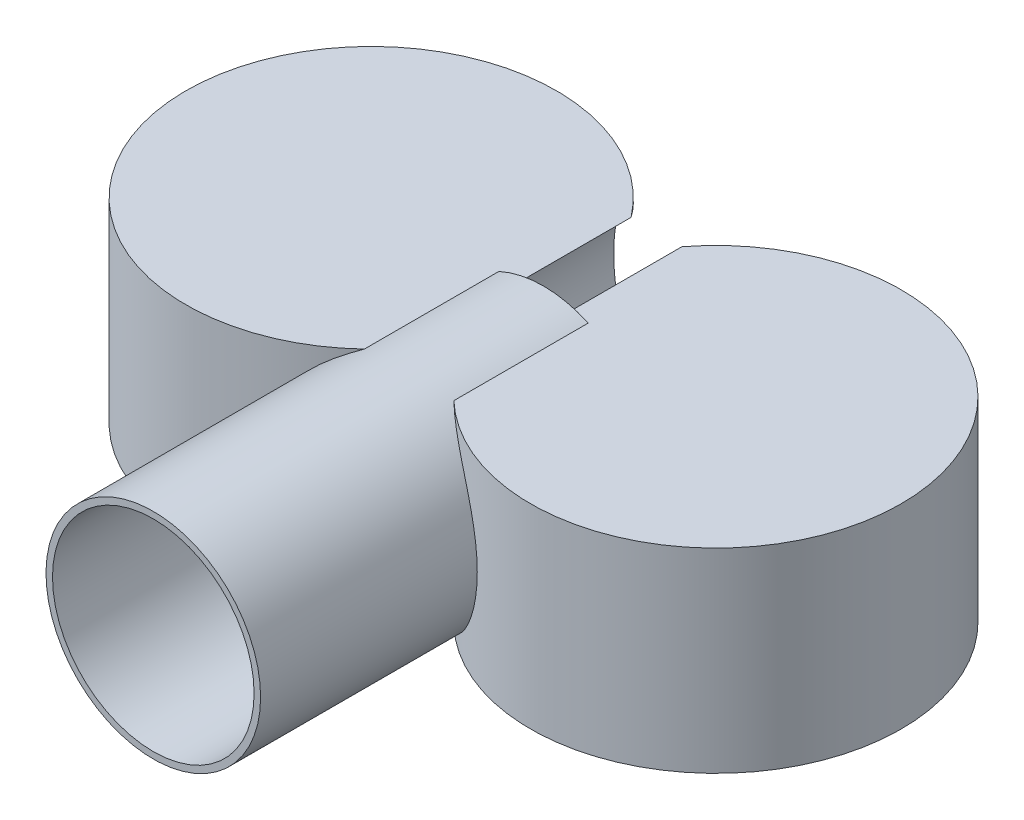
from build123d import *

# Parameters (mm, degrees)
BOSS_EXTRUDE1_DEPTH = 30
SKETCH2_R           = 16.5
BOSS_EXTRUDE2_DEPTH = 60
SKETCH3_R           = 15.5
CUT_EXTRUDE1_DEPTH  = 118.763469435


with BuildPart() as part:
    # Sketch1 → Boss-Extrude1 (new body)
    with BuildSketch(Plane(origin=(0, 0, 0), x_dir=(1, 0, 0), z_dir=(0, 1, 0))):
        with BuildLine():
            ThreePointArc((-16.019255805, 10.488088482), (-71.019255805, 0), (-16.019255805, -10.488088482))
            ThreePointArc((-16.019255805, -10.488088482), (38.980744195, 0), (-16.019255805, 10.488088482))
        make_face()
    extrude(amount=BOSS_EXTRUDE1_DEPTH)

    # Sketch2 → Boss-Extrude2 (add)
    with BuildSketch(Plane.XY):
        with Locations(Location((-16.019255805, 15, 0), (0, 0, 245.380016324))):
            Circle(SKETCH2_R)
    extrude(amount=BOSS_EXTRUDE2_DEPTH)

    # Sketch3 → Cut-Extrude1 (cut, through all)
    with BuildSketch(Plane.XY.offset(60)):
        with Locations((-16.019255805, 15)):
            Circle(SKETCH3_R)
    extrude(amount=-CUT_EXTRUDE1_DEPTH, mode=Mode.SUBTRACT)


solid = part.part
